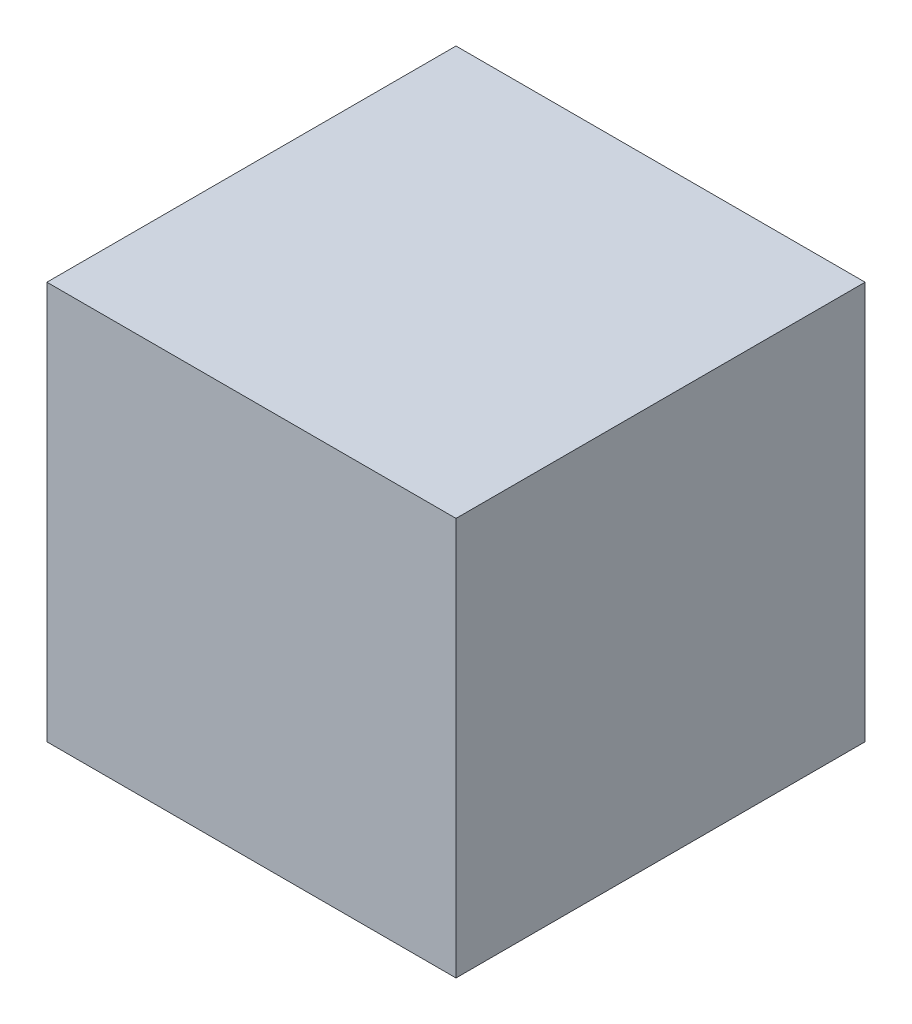
from build123d import *

# Parameters (mm, degrees)
SKETCH1_W           = 939.8
SKETCH1_H           = 939.8
BOSS_EXTRUDE1_DEPTH = 914.4


with BuildPart() as part:
    # Sketch1 → Boss-Extrude1 (new body)
    with BuildSketch(Plane(origin=(0, 0, 0), x_dir=(1, 0, 0), z_dir=(0, 1, 0))):
        Rectangle(SKETCH1_W, SKETCH1_H)
    extrude(amount=BOSS_EXTRUDE1_DEPTH)


solid = part.part
